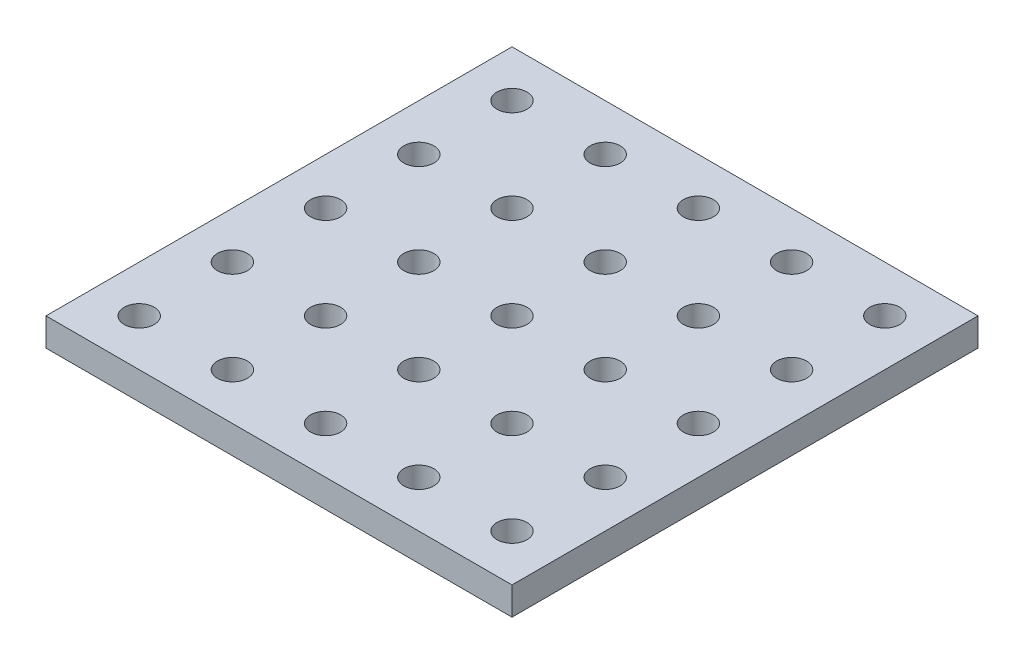
from build123d import *

# Parameters (mm, degrees)
SKETCH1_W           = 250
SKETCH1_H           = 250
BOSS_EXTRUDE1_DEPTH = 15
SKETCH2_R           = 8.05
CUT_EXTRUDE1_DEPTH  = 178.411949992


with BuildPart() as part:
    # Sketch1 → Boss-Extrude1 (new body)
    with BuildSketch(Plane(origin=(0, 0, 0), x_dir=(1, 0, 0), z_dir=(0, 1, 0))):
        Rectangle(SKETCH1_W, SKETCH1_H)
    extrude(amount=BOSS_EXTRUDE1_DEPTH)

    # Sketch2 → Cut-Extrude1 (cut, through all)
    with BuildSketch(Plane(origin=(0, 15, 0), x_dir=(1, 0, 0), z_dir=(0, 1, 0))):
        with Locations(Location((-100, 100, 0), (0, 0, 270))):
            Circle(SKETCH2_R)
        with Locations(Location((-50, 100, 0), (0, 0, 270))):
            Circle(SKETCH2_R)
        with Locations(Location((0, 100, 0), (0, 0, 270))):
            Circle(SKETCH2_R)
        with Locations(Location((50, 100, 0), (0, 0, 270))):
            Circle(SKETCH2_R)
        with Locations(Location((100, 100, 0), (0, 0, 270))):
            Circle(SKETCH2_R)
        with Locations(Location((-50, 50, 0), (0, 0, 270))):
            Circle(SKETCH2_R)
        with Locations(Location((0, 50, 0), (0, 0, 270))):
            Circle(SKETCH2_R)
        with Locations(Location((50, 50, 0), (0, 0, 270))):
            Circle(SKETCH2_R)
        with Locations(Location((100, 50, 0), (0, 0, 270))):
            Circle(SKETCH2_R)
        with Locations(Location((-50, 0, 0), (0, 0, 270))):
            Circle(SKETCH2_R)
        with Locations(Location((0, 0, 0), (0, 0, 270))):
            Circle(SKETCH2_R)
        with Locations(Location((50, 0, 0), (0, 0, 270))):
            Circle(SKETCH2_R)
        with Locations(Location((100, 0, 0), (0, 0, 270))):
            Circle(SKETCH2_R)
        with Locations(Location((-50, -50, 0), (0, 0, 270))):
            Circle(SKETCH2_R)
        with Locations(Location((0, -50, 0), (0, 0, 270))):
            Circle(SKETCH2_R)
        with Locations(Location((50, -50, 0), (0, 0, 270))):
            Circle(SKETCH2_R)
        with Locations(Location((100, -50, 0), (0, 0, 270))):
            Circle(SKETCH2_R)
        with Locations(Location((-50, -100, 0), (0, 0, 270))):
            Circle(SKETCH2_R)
        with Locations(Location((0, -100, 0), (0, 0, 270))):
            Circle(SKETCH2_R)
        with Locations(Location((50, -100, 0), (0, 0, 270))):
            Circle(SKETCH2_R)
        with Locations(Location((100, -100, 0), (0, 0, 270))):
            Circle(SKETCH2_R)
        with Locations(Location((-100, 50, 0), (0, 0, 270))):
            Circle(SKETCH2_R)
        with Locations(Location((-100, 0, 0), (0, 0, 270))):
            Circle(SKETCH2_R)
        with Locations(Location((-100, -50, 0), (0, 0, 270))):
            Circle(SKETCH2_R)
        with Locations(Location((-100, -100, 0), (0, 0, 270))):
            Circle(SKETCH2_R)
    extrude(amount=-CUT_EXTRUDE1_DEPTH, mode=Mode.SUBTRACT)


solid = part.part
